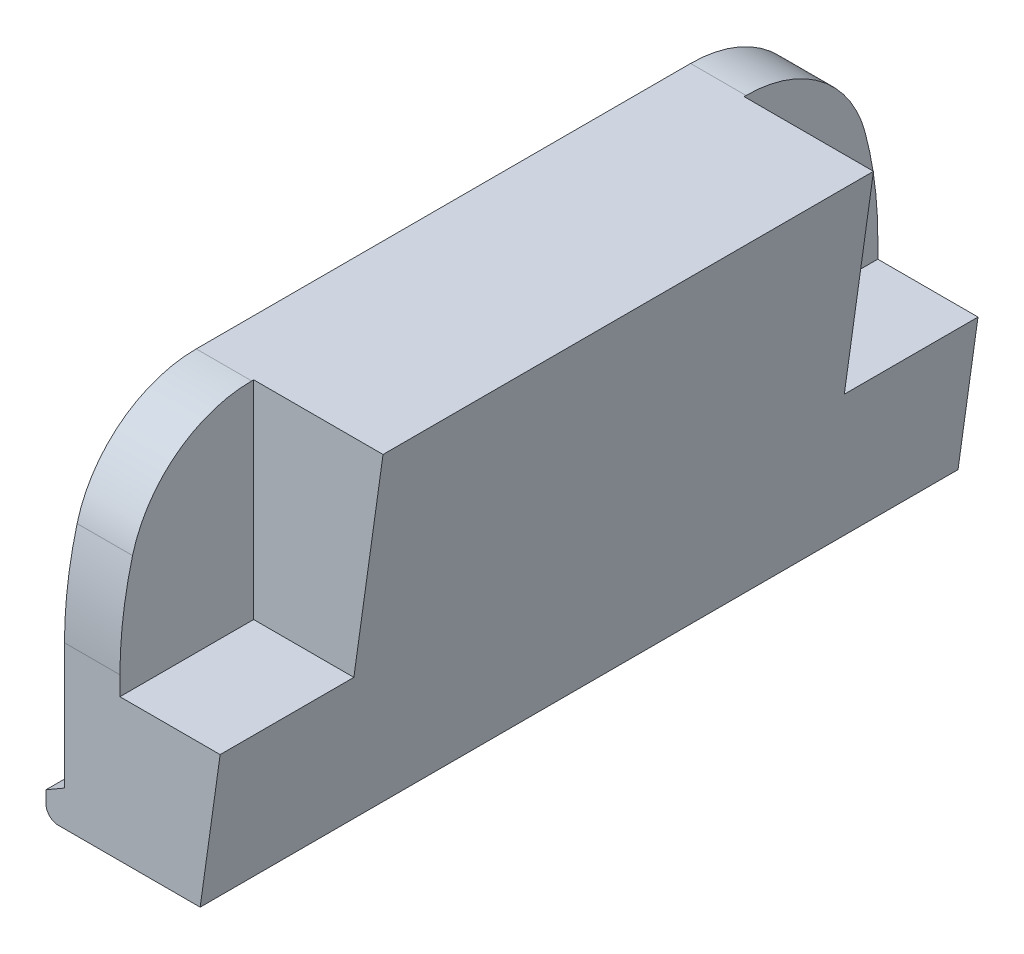
from build123d import *

# Parameters (mm, degrees)
BOSS_EXTRUDE1_DEPTH = 12.3
SKETCH2_W           = 2.1
SKETCH2_H           = 2.17
CUT_EXTRUDE1_DEPTH  = 4.2
CUT_EXTRUDE3_DEPTH  = 0.9
SKETCH5_W           = 3
SKETCH5_H           = 1
BOSS_EXTRUDE2_DEPTH = 0.55
BOSS_EXTRUDE3_DEPTH = 3
SKETCH7_W           = 13.013136742
SKETCH7_H           = 0.83
CUT_EXTRUDE4_DEPTH  = 15.056708453
FILLET1_R           = 2
CUT_EXTRUDE8_DEPTH  = 14.785193345


with BuildPart() as part:
    # Sketch1 → Boss-Extrude1 (new body)
    with BuildSketch(Plane.XY):
        with BuildLine():
            Line((0, 0), (0.299997713, 0.173208719))
            Line((0.299997713, 0.173208719), (0.299997713, 1.781598719))
            Line((0.299997713, 1.781598719), (0.299997713, 6.107458719))
            Line((0.299997713, 6.107458719), (3.299997713, 6.107458719))
            Line((3.299997713, 6.107458719), (3.299997713, 0.646828719))
            Line((3.299997713, 0.646828719), (3.299997713, -0.4))
            Line((3.299997713, -0.4), (0.2, -0.4))
            ThreePointArc((0.2, -0.4), (0.058578644, -0.341421356), (0, -0.2))
            Line((0, -0.2), (0, 0))
        make_face()
    extrude(amount=BOSS_EXTRUDE1_DEPTH)

    # Sketch2 → Cut-Extrude1 (cut)
    with BuildSketch(Plane(origin=(0, 6.107458719, 0), x_dir=(1, 0, 0), z_dir=(0, 1, 0))):
        with Locations((2.249997713, -1.085)):
            Rectangle(SKETCH2_W, SKETCH2_H)
        with Locations((2.249997713, -11.215)):
            Rectangle(SKETCH2_W, SKETCH2_H)
    extrude(amount=-CUT_EXTRUDE1_DEPTH, mode=Mode.SUBTRACT)

    # Sketch4 → Cut-Extrude3 (cut)
    with BuildSketch(Plane.ZY.offset(-0.299997713)):
        with BuildLine():
            Line((10.41158, 6.107458719), (12.3, 6.107458719))
            Line((12.3, 6.107458719), (12.3, 2.215929667))
            ThreePointArc((12.3, 2.215929667), (12.02880398, 4.022129667), (11.23913234, 5.669043272))
            ThreePointArc((11.23913234, 5.669043272), (10.879869522, 5.991150317), (10.41158, 6.107458719))
        make_face()
        with BuildLine():
            Line((1.88842, 6.107458719), (0, 6.107458719))
            Line((0, 6.107458719), (0, 2.215929667))
            ThreePointArc((0, 2.215929667), (0.27119602, 4.022129667), (1.06086766, 5.669043272))
            ThreePointArc((1.06086766, 5.669043272), (1.420130478, 5.991150317), (1.88842, 6.107458719))
        make_face()
    extrude(amount=-CUT_EXTRUDE3_DEPTH, mode=Mode.SUBTRACT)

    # Sketch5 → Boss-Extrude2 (add)
    with BuildSketch(Plane.ZY.offset(-0.299997713)):
        with Locations((6.15, 2.281598719)):
            Rectangle(SKETCH5_W, SKETCH5_H)
    extrude(amount=BOSS_EXTRUDE2_DEPTH)

    # Sketch6 → Boss-Extrude3 (add)
    with BuildSketch(Plane.XY.offset(7.65)):
        Polygon((0.299997713, 2.781598719), (0.299997713, 4.373208719), (-0.250002287, 2.781598719), align=None)
    extrude(amount=-BOSS_EXTRUDE3_DEPTH)

    # Sketch7 → Cut-Extrude4 (cut, through all)
    with BuildSketch(Plane.ZY.offset(-0.299997713)):
        with Locations((5.954326159, 5.69245873)):
            Rectangle(SKETCH7_W, SKETCH7_H)
    extrude(amount=-CUT_EXTRUDE4_DEPTH, mode=Mode.SUBTRACT)

    # Fillet1
    fillet1_edges = [part.edges().sort_by_distance(p)[0] for p in [
        (0.749997713, 5.27745873, 0.816134079),
        (0.749997713, 5.27745873, 11.483865921),
    ]]
    fillet(fillet1_edges, radius=FILLET1_R)

    # Sketch16 → Cut-Extrude8 (cut, through all)
    with BuildSketch(Plane.XY.offset(12.3)):
        Polygon((3.299997713, 5.27745873), (3.299997713, -0.4), (2.502082924, -0.4), align=None)
    extrude(amount=-CUT_EXTRUDE8_DEPTH, mode=Mode.SUBTRACT)


solid = part.part
